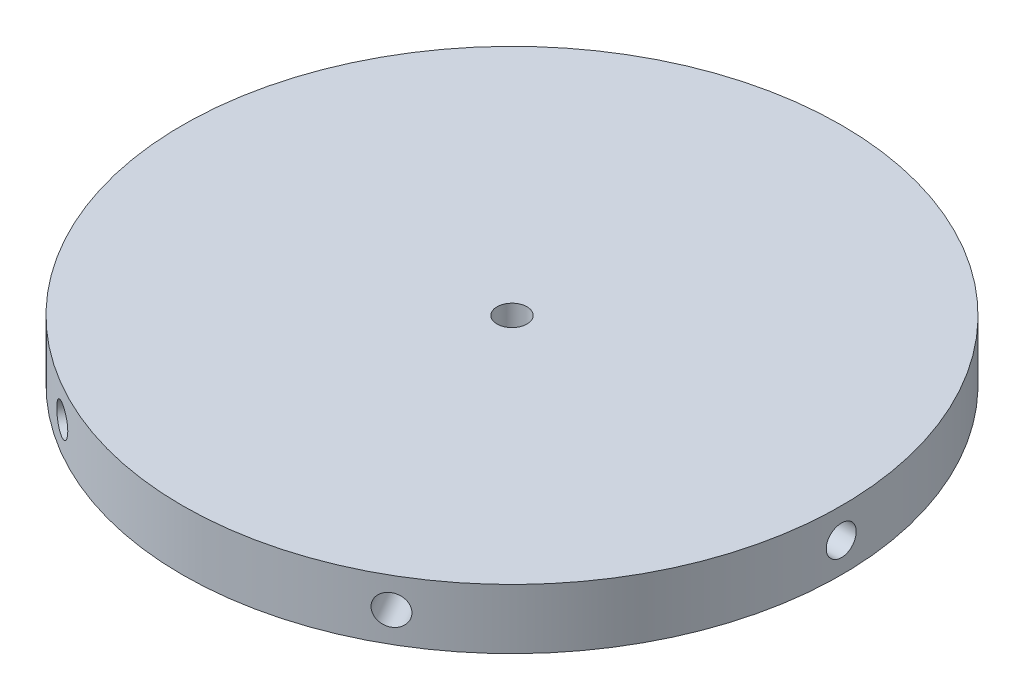
from build123d import *

# Parameters (mm, degrees)
SKETCH1_R           = 69.85
SKETCH1_R_2         = 3.175
BOSS_EXTRUDE1_DEPTH = 12.7
SKETCH2_R           = 3.175
CUT_EXTRUDE1_DEPTH  = 12.7
CIRPATTERN1_COUNT   = 6


with BuildPart() as part:
    # Sketch1 → Boss-Extrude1 (new body)
    with BuildSketch(Plane(origin=(0, 0, 0), x_dir=(1, 0, 0), z_dir=(0, 1, 0))):
        with Locations(Location((0, 0, 0), (0, 0, 270))):
            Circle(SKETCH1_R)
        with Locations(Location((0, 0, 0), (0, 0, 270))):
            Circle(SKETCH1_R_2, mode=Mode.SUBTRACT)
    extrude(amount=BOSS_EXTRUDE1_DEPTH)

    # Sketch2 → Cut-Extrude1 (cut)
    with BuildSketch(Plane(origin=(73.914, 0, 0), x_dir=(0, 0, -1), z_dir=(1, 0, 0))):
        with Locations((0, 6.35)):
            Circle(SKETCH2_R)
    cut_extrude1 = extrude(amount=-CUT_EXTRUDE1_DEPTH, mode=Mode.SUBTRACT)

    # CirPattern1: Cut-Extrude1 ×6 about axis
    cirpattern1_axis = Axis((0, 0, 0), (0, 1, 0))
    for i in range(1, CIRPATTERN1_COUNT):
        add(cut_extrude1.rotate(cirpattern1_axis, i * 360 / CIRPATTERN1_COUNT), mode=Mode.SUBTRACT)


solid = part.part
